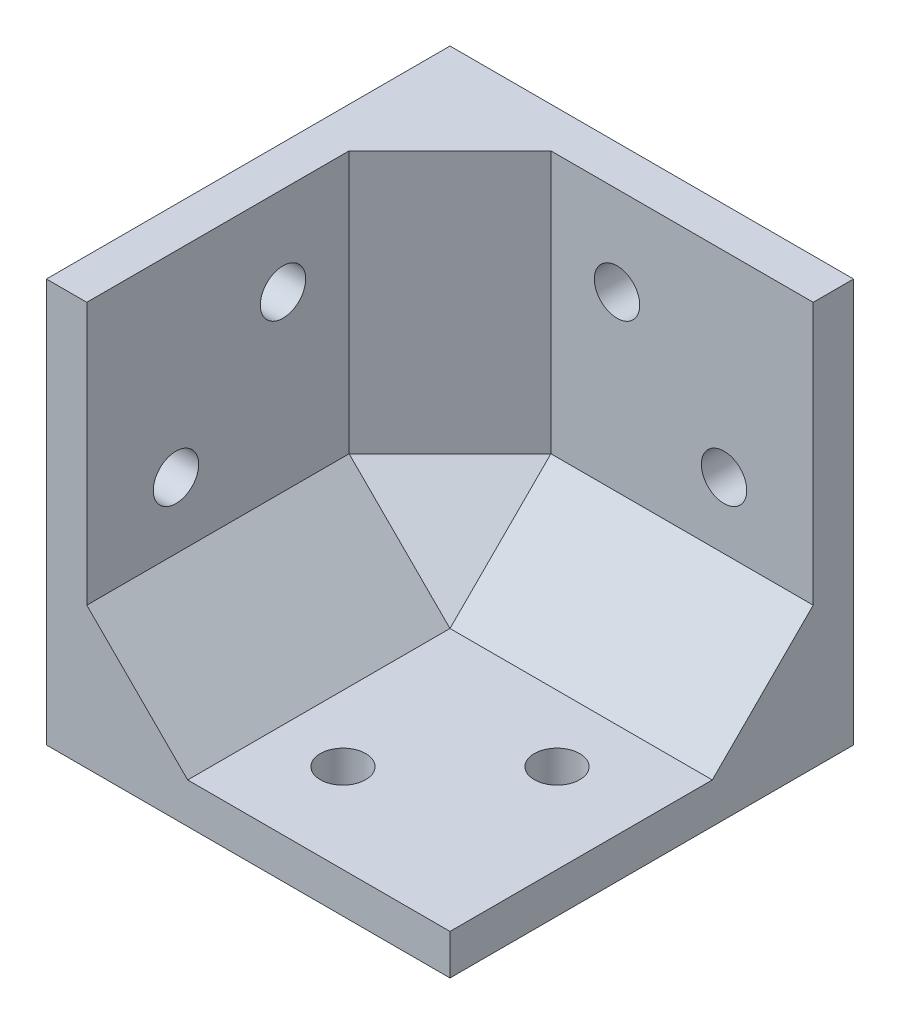
from build123d import *

# Parameters (mm, degrees)
SCHIZZO1_W                   = 40
SCHIZZO1_H                   = 40
ESTRUSIONE_ESTRUSIONE1_DEPTH = 4
ESTRUSIONE_ESTRUSIONE2_DEPTH = 36
SMUSSO1_SIZE                 = 10
FORO_PER_VITE_M4_1_D         = 4.5
FORO_PER_VITE_M4_1_DEPTH     = 9
FORO_PER_VITE_M4_1_TIP       = 1.351936393
FORO_PER_VITE_M4_2_D         = 4.5
FORO_PER_VITE_M4_2_DEPTH     = 9
FORO_PER_VITE_M4_2_TIP       = 1.351936393
FORO_PER_VITE_M4_3_D         = 4.5
FORO_PER_VITE_M4_3_DEPTH     = 9
FORO_PER_VITE_M4_3_TIP       = 1.351936393


with BuildPart() as part:
    # Schizzo1 → Estrusione-Estrusione1 (new body)
    with BuildSketch(Plane(origin=(0, 0, 0), x_dir=(1, 0, 0), z_dir=(0, 1, 0))):
        with Locations((-20, 20)):
            Rectangle(SCHIZZO1_W, SCHIZZO1_H)
    extrude(amount=ESTRUSIONE_ESTRUSIONE1_DEPTH)

    # Schizzo2 → Estrusione-Estrusione2 (add)
    with BuildSketch(Plane(origin=(0, 4, 0), x_dir=(1, 0, 0), z_dir=(0, 1, 0))):
        Polygon((-36, 0), (-40, 0), (-40, 40), (0, 40), (0, 36), (-36, 36), align=None)
    extrude(amount=ESTRUSIONE_ESTRUSIONE2_DEPTH)

    # Smusso1
    smusso1_edges = [part.edges().sort_by_distance(p)[0] for p in [
        (-36, 4, -18),
        (-18, 4, -36),
        (-36, 22, -36),
    ]]
    chamfer(smusso1_edges, length=SMUSSO1_SIZE)

    # Foro per Vite M4-1
    with Locations(Plane(origin=(0, 0, 0), x_dir=(-1, 0, 0), z_dir=(0, -1, 0))):
        with Locations((8.838834765, 19.445436483), (19.445436483, 8.838834765)):
            Hole(FORO_PER_VITE_M4_1_D / 2, depth=FORO_PER_VITE_M4_1_DEPTH)
            with Locations((0, 0, -(FORO_PER_VITE_M4_1_DEPTH + FORO_PER_VITE_M4_1_TIP / 2))):  # 118° drill point
                Cone(0, FORO_PER_VITE_M4_1_D / 2, FORO_PER_VITE_M4_1_TIP, mode=Mode.SUBTRACT)

    # Foro per Vite M4-2
    with Locations(Plane(origin=(0, 0, -40), x_dir=(-1, 0, 0), z_dir=(0, 0, -1))):
        with Locations((8.838834765, 20.554563517), (19.445436483, 31.161165235)):
            Hole(FORO_PER_VITE_M4_2_D / 2, depth=FORO_PER_VITE_M4_2_DEPTH)
            with Locations((0, 0, -(FORO_PER_VITE_M4_2_DEPTH + FORO_PER_VITE_M4_2_TIP / 2))):  # 118° drill point
                Cone(0, FORO_PER_VITE_M4_2_D / 2, FORO_PER_VITE_M4_2_TIP, mode=Mode.SUBTRACT)

    # Foro per Vite M4-3
    with Locations(Plane.ZY.offset(40)):
        with Locations((-19.445436483, 31.161165235), (-8.838834765, 20.554563517)):
            Hole(FORO_PER_VITE_M4_3_D / 2, depth=FORO_PER_VITE_M4_3_DEPTH)
            with Locations((0, 0, -(FORO_PER_VITE_M4_3_DEPTH + FORO_PER_VITE_M4_3_TIP / 2))):  # 118° drill point
                Cone(0, FORO_PER_VITE_M4_3_D / 2, FORO_PER_VITE_M4_3_TIP, mode=Mode.SUBTRACT)


solid = part.part
